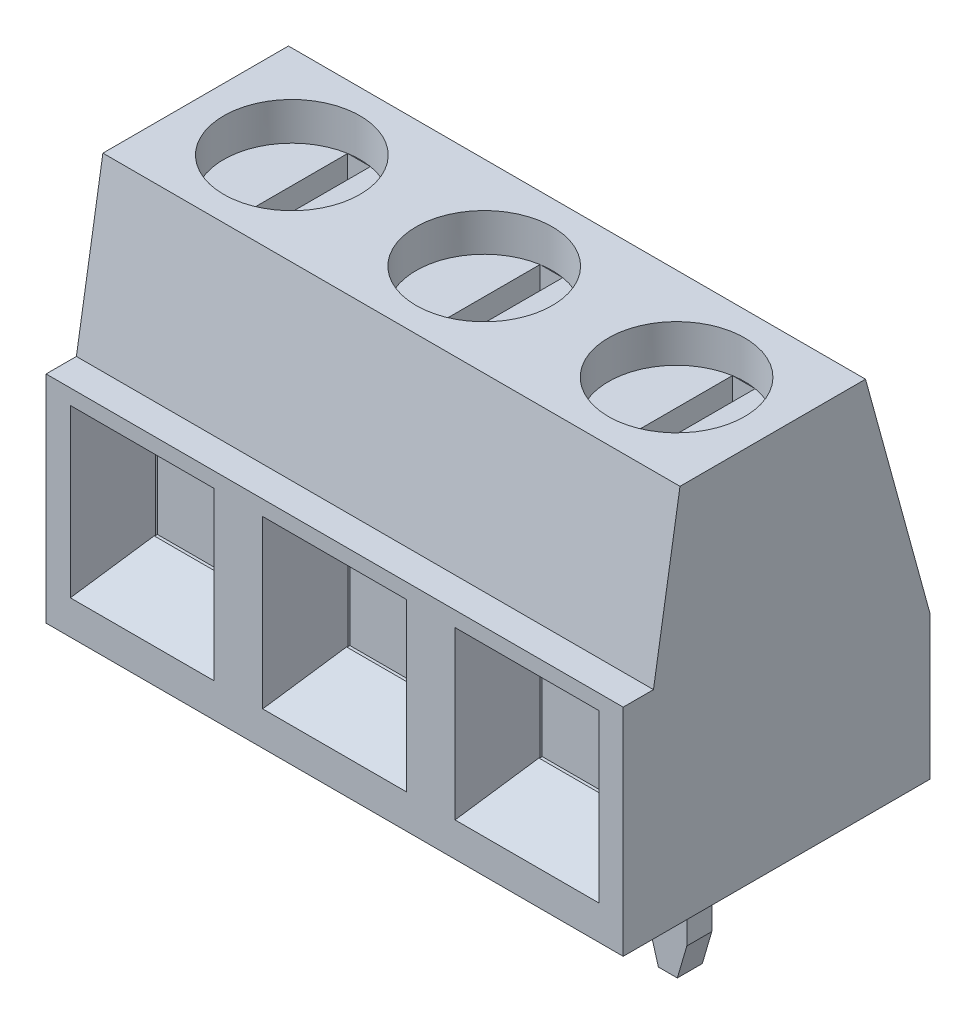
from build123d import *

# Parameters (mm, degrees)
SKETCH1_W                   = 15.24
SKETCH1_H                   = 8.1
BOSS_EXTRUDE1_DEPTH         = 10
CUT_EXTRUDE1_DEPTH          = 20.946618761
CUT_EXTRUDE2_DEPTH          = 20.946618761
SKETCH4_W                   = 1
SKETCH4_H                   = 0.66
BOSS_EXTRUDE2_DEPTH         = 3.5
CUT_EXTRUDE3_REACH          = 20.747
LPATTERN1_COUNT             = 3
LPATTERN1_PITCH             = 5.08
SKETCH6_W                   = 2.6
SKETCH6_H                   = 1.9
CUT_EXTRUDE4_DEPTH          = 1.7
CHAMFER1_SIZE               = 0.6
CHAMFER1_SIZE2              = 1.648486452
CHAMFER2_SIZE               = 0.6
CHAMFER2_SIZE2              = 1.648486452
CHAMFER3_SIZE               = 1.6
CHAMFER4_SIZE               = 0.9
CHAMFER4_SIZE2              = 1.62364298
LPATTERN2_COUNT             = 3
LPATTERN2_PITCH             = 5.08
CHAMFER1_OF_LPATTERN2_SIZE2 = 1.648486452
CHAMFER1_OF_LPATTERN2_SIZE  = 0.6
CHAMFER2_OF_LPATTERN2_SIZE2 = 1.648486452
CHAMFER2_OF_LPATTERN2_SIZE  = 0.6
CHAMFER3_OF_LPATTERN2_SIZE  = 1.6
CHAMFER4_OF_LPATTERN2_SIZE2 = 1.62364298
CHAMFER4_OF_LPATTERN2_SIZE  = 0.9
SKETCH7_R                   = 1.8
CUT_EXTRUDE5_DEPTH          = 1
SKETCH8_W                   = 0.6
SKETCH8_H                   = 3.54964787
CUT_EXTRUDE6_DEPTH          = 1
LPATTERN3_COUNT             = 3
LPATTERN3_PITCH             = 5.08


with BuildPart() as part:
    # Sketch1 → Boss-Extrude1 (new body)
    with BuildSketch(Plane(origin=(0, 0, 0), x_dir=(1, 0, 0), z_dir=(0, 1, 0))):
        with Locations((7.62, 4.05)):
            Rectangle(SKETCH1_W, SKETCH1_H)
    extrude(amount=BOSS_EXTRUDE1_DEPTH)

    # Sketch2 → Cut-Extrude1 (cut, through all)
    with BuildSketch(Plane(origin=(15.24, 0, 0), x_dir=(0, 0, -1), z_dir=(1, 0, 0))):
        Polygon((0, 10), (1.5, 10), (0.8, 5.7), (0, 5.7), align=None)
    extrude(amount=-CUT_EXTRUDE1_DEPTH, mode=Mode.SUBTRACT)

    # Sketch3 → Cut-Extrude2 (cut, through all)
    with BuildSketch(Plane(origin=(15.24, 0, 0), x_dir=(0, 0, -1), z_dir=(1, 0, 0))):
        Polygon((8.1, 3.8), (6.4, 10), (8.1, 10), align=None)
    extrude(amount=-CUT_EXTRUDE2_DEPTH, mode=Mode.SUBTRACT)

    # Sketch4 → Boss-Extrude2 (add)
    with BuildSketch(Plane.XZ):
        with Locations((2.54, -4.05)):
            Rectangle(SKETCH4_W, SKETCH4_H)
    boss_extrude2 = extrude(amount=BOSS_EXTRUDE2_DEPTH)

    # Sketch5 → Cut-Extrude3 (cut, up to next)
    with BuildSketch(Plane.XY.offset(-3.72), mode=Mode.PRIVATE) as cut_extrude3_sk1:
        Polygon((2.04, -2.643369181), (2.29, -3.5), (2.04, -3.5), align=None)
    cut_extrude3_tool1 = extrude(cut_extrude3_sk1.sketch, amount=-CUT_EXTRUDE3_REACH, mode=Mode.PRIVATE) & part.part
    # Sketch5 → Cut-Extrude3 (cut, up to next)
    with BuildSketch(Plane.XY.offset(-3.72), mode=Mode.PRIVATE) as cut_extrude3_sk2:
        Polygon((2.79, -3.5), (3.04, -3.5), (3.04, -2.643369181), align=None)
    cut_extrude3_tool2 = extrude(cut_extrude3_sk2.sketch, amount=-CUT_EXTRUDE3_REACH, mode=Mode.PRIVATE) & part.part
    cut_extrude3_1 = cut_extrude3_tool1.solids().sort_by_distance((2.123333, -3.214456, -3.72))[0]
    add(cut_extrude3_1, mode=Mode.SUBTRACT)
    cut_extrude3_2 = cut_extrude3_tool2.solids().sort_by_distance((2.956667, -3.214456, -3.72))[0]
    add(cut_extrude3_2, mode=Mode.SUBTRACT)
    cut_extrude3 = cut_extrude3_1 + cut_extrude3_2  # Cut-Extrude3 as one shape, for the pattern or mirror that repeats it

    # LPattern1: Boss-Extrude2, Cut-Extrude3 ×3
    with Locations(*[(i * LPATTERN1_PITCH, 0, 0) for i in range(1, LPATTERN1_COUNT)]):
        add(boss_extrude2)
        add(cut_extrude3, mode=Mode.SUBTRACT)

    # Sketch6 → Cut-Extrude4 (cut)
    with BuildSketch(Plane.XY):
        with Locations((2.54, 2.75)):
            Rectangle(SKETCH6_W, SKETCH6_H)
    cut_extrude4 = extrude(amount=-CUT_EXTRUDE4_DEPTH, mode=Mode.SUBTRACT)

    # Chamfer1
    chamfer1_edges = [part.edges().sort_by_distance(p)[0] for p in [
        (1.24, 2.75, 0),
    ]]
    chamfer1_side = [part.faces().sort_by_distance(p)[0] for p in [
        (7.926307978, 2.856029685, 0),
    ]]
    chamfer(chamfer1_edges, length=CHAMFER1_SIZE, length2=CHAMFER1_SIZE2, reference=chamfer1_side[0])

    # Chamfer2
    chamfer2_edges = [part.edges().sort_by_distance(p)[0] for p in [
        (3.84, 2.75, 0),
    ]]
    chamfer2_side = [part.faces().sort_by_distance(p)[0] for p in [
        (8.024891816, 2.85752587, 0),
    ]]
    chamfer(chamfer2_edges, length=CHAMFER2_SIZE, length2=CHAMFER2_SIZE2, reference=chamfer2_side[0])

    # Chamfer3
    chamfer3_edges = [part.edges().sort_by_distance(p)[0] for p in [
        (2.54, 3.7, 0),
    ]]
    chamfer(chamfer3_edges, length=CHAMFER3_SIZE)

    # Chamfer4
    chamfer4_edges = [part.edges().sort_by_distance(p)[0] for p in [
        (2.54, 1.8, 0),
    ]]
    chamfer4_side = [part.faces().sort_by_distance(p)[0] for p in [
        (8.53838843, 2.723450413, 0),
    ]]
    chamfer(chamfer4_edges, length=CHAMFER4_SIZE, length2=CHAMFER4_SIZE2, reference=chamfer4_side[0])

    # LPattern2: Cut-Extrude4 ×3
    with Locations(*[(i * LPATTERN2_PITCH, 0, 0) for i in range(1, LPATTERN2_COUNT)]):
        add(cut_extrude4, mode=Mode.SUBTRACT)

    # Chamfer1 of LPattern2
    chamfer1_of_lpattern2_edges = [part.edges().sort_by_distance(p)[0] for p in [
        (6.32, 2.75, 0),
        (11.4, 2.75, 0),
    ]]
    chamfer(chamfer1_of_lpattern2_edges, length=CHAMFER1_OF_LPATTERN2_SIZE, length2=CHAMFER1_OF_LPATTERN2_SIZE2)

    # Chamfer2 of LPattern2
    chamfer2_of_lpattern2_edges = [part.edges().sort_by_distance(p)[0] for p in [
        (8.92, 2.75, 0),
        (14, 2.75, 0),
    ]]
    chamfer(chamfer2_of_lpattern2_edges, length=CHAMFER2_OF_LPATTERN2_SIZE, length2=CHAMFER2_OF_LPATTERN2_SIZE2)

    # Chamfer3 of LPattern2
    chamfer3_of_lpattern2_edges = [part.edges().sort_by_distance(p)[0] for p in [
        (7.62, 3.7, 0),
        (12.7, 3.7, 0),
    ]]
    chamfer(chamfer3_of_lpattern2_edges, length=CHAMFER3_OF_LPATTERN2_SIZE)

    # Chamfer4 of LPattern2
    chamfer4_of_lpattern2_edges = [part.edges().sort_by_distance(p)[0] for p in [
        (7.62, 1.8, 0),
        (12.7, 1.8, 0),
    ]]
    chamfer(chamfer4_of_lpattern2_edges, length=CHAMFER4_OF_LPATTERN2_SIZE, length2=CHAMFER4_OF_LPATTERN2_SIZE2)

    # Sketch7 → Cut-Extrude5 (cut)
    with BuildSketch(Plane(origin=(0, 10, 0), x_dir=(1, 0, 0), z_dir=(0, 1, 0))):
        with Locations(Location((12.7, 3.95, 0), (0, 0, 270))):
            Circle(SKETCH7_R)
    cut_extrude5 = extrude(amount=-CUT_EXTRUDE5_DEPTH, mode=Mode.SUBTRACT)

    # Sketch8 → Cut-Extrude6 (cut)
    with BuildSketch(Plane(origin=(0, 9, 0), x_dir=(1, 0, 0), z_dir=(0, 1, 0))):
        with Locations((12.7, 3.95)):
            Rectangle(SKETCH8_W, SKETCH8_H)
    cut_extrude6 = extrude(amount=-CUT_EXTRUDE6_DEPTH, mode=Mode.SUBTRACT)

    # LPattern3: Cut-Extrude5, Cut-Extrude6 ×3
    with Locations(*[(-i * LPATTERN3_PITCH, 0, 0) for i in range(1, LPATTERN3_COUNT)]):
        add(cut_extrude5, mode=Mode.SUBTRACT)
        add(cut_extrude6, mode=Mode.SUBTRACT)


solid = part.part
